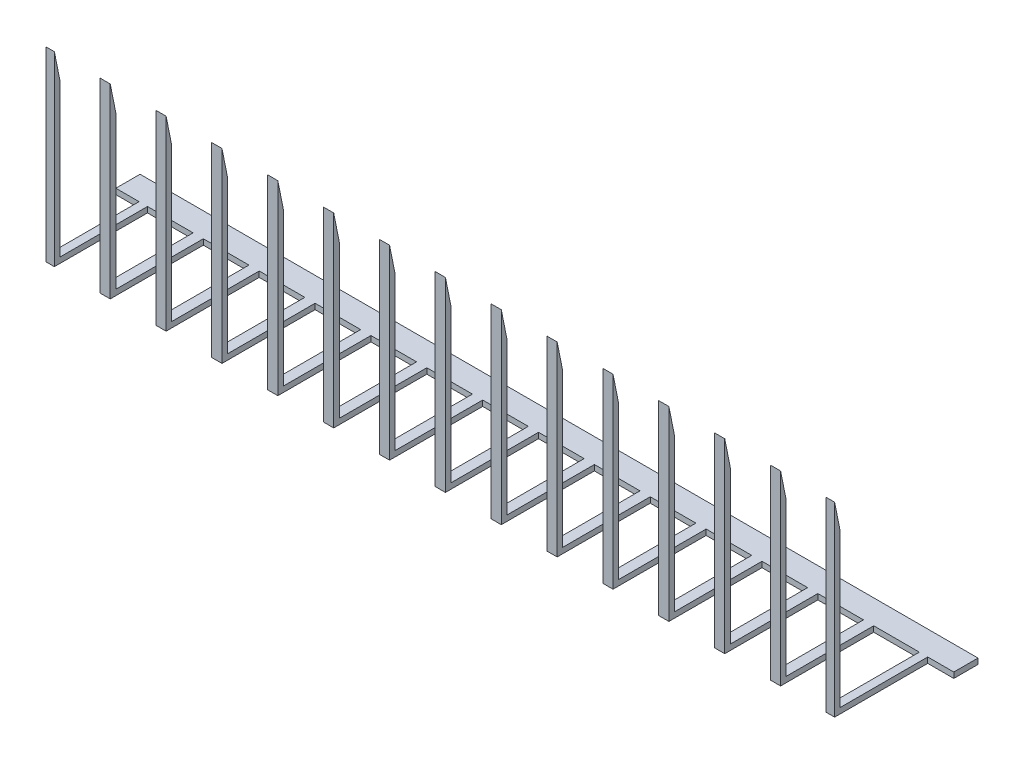
from build123d import *

# Parameters (mm, degrees)
SKETCH_1_W          = 450
SKETCH_1_H          = 60
EXTRUDE_1_DEPTH     = 3
SKETCH_2_W          = 450
SKETCH_2_H          = 100
EXTRUDE_2_DEPTH     = 3
CUT_EXTRUDE_2_DEPTH = 465.865571967
SKETCH_3_W          = 14
SKETCH_3_H          = 50
SKETCH_3_W_2        = 24.5
SKETCH_3_W_3        = 12.5
CUT_EXTRUDE_3_DEPTH = 465.865571967


with BuildPart() as part:
    # 草图1 → 凸台-拉伸1 (new body)
    with BuildSketch(Plane(origin=(0, 0, 0), x_dir=(1, 0, 0), z_dir=(0, 1, 0))):
        with Locations((225, 30)):
            Rectangle(SKETCH_1_W, SKETCH_1_H)
    extrude(amount=EXTRUDE_1_DEPTH)

    # 草图2 → 凸台-拉伸2 (add)
    with BuildSketch(Plane.XY):
        with Locations((225, 50)):
            Rectangle(SKETCH_2_W, SKETCH_2_H)
    extrude(amount=EXTRUDE_2_DEPTH)

    # 草图6 → 切除-拉伸2 (cut, through all)
    with BuildSketch(Plane(origin=(450, 0, 0), x_dir=(0, 0, -1), z_dir=(1, 0, 0))):
        Polygon((-3, 100), (0, 85), (0, 100), align=None)
    extrude(amount=-CUT_EXTRUDE_2_DEPTH, mode=Mode.SUBTRACT)

    # 草图3 → 切除-拉伸3 (cut, through all)
    with BuildSketch(Plane.XZ):
        with Locations((443, -22)):
            Rectangle(SKETCH_3_W, SKETCH_3_H)
        with Locations((419.25, -22)):
            Rectangle(SKETCH_3_W_2, SKETCH_3_H)
        with Locations((389.25, -22)):
            Rectangle(SKETCH_3_W_2, SKETCH_3_H)
        with Locations((359.25, -22)):
            Rectangle(SKETCH_3_W_2, SKETCH_3_H)
        with Locations((329.25, -22)):
            Rectangle(SKETCH_3_W_2, SKETCH_3_H)
        with Locations((299.25, -22)):
            Rectangle(SKETCH_3_W_2, SKETCH_3_H)
        with Locations((269.25, -22)):
            Rectangle(SKETCH_3_W_2, SKETCH_3_H)
        with Locations((239.25, -22)):
            Rectangle(SKETCH_3_W_2, SKETCH_3_H)
        with Locations((209.25, -22)):
            Rectangle(SKETCH_3_W_2, SKETCH_3_H)
        with Locations((179.25, -22)):
            Rectangle(SKETCH_3_W_2, SKETCH_3_H)
        with Locations((149.25, -22)):
            Rectangle(SKETCH_3_W_2, SKETCH_3_H)
        with Locations((119.25, -22)):
            Rectangle(SKETCH_3_W_2, SKETCH_3_H)
        with Locations((89.25, -22)):
            Rectangle(SKETCH_3_W_2, SKETCH_3_H)
        with Locations((59.25, -22)):
            Rectangle(SKETCH_3_W_2, SKETCH_3_H)
        with Locations((29.25, -22)):
            Rectangle(SKETCH_3_W_2, SKETCH_3_H)
        with Locations((6.25, -22)):
            Rectangle(SKETCH_3_W_3, SKETCH_3_H)
    extrude(amount=-CUT_EXTRUDE_3_DEPTH, mode=Mode.SUBTRACT)


solid = part.part
